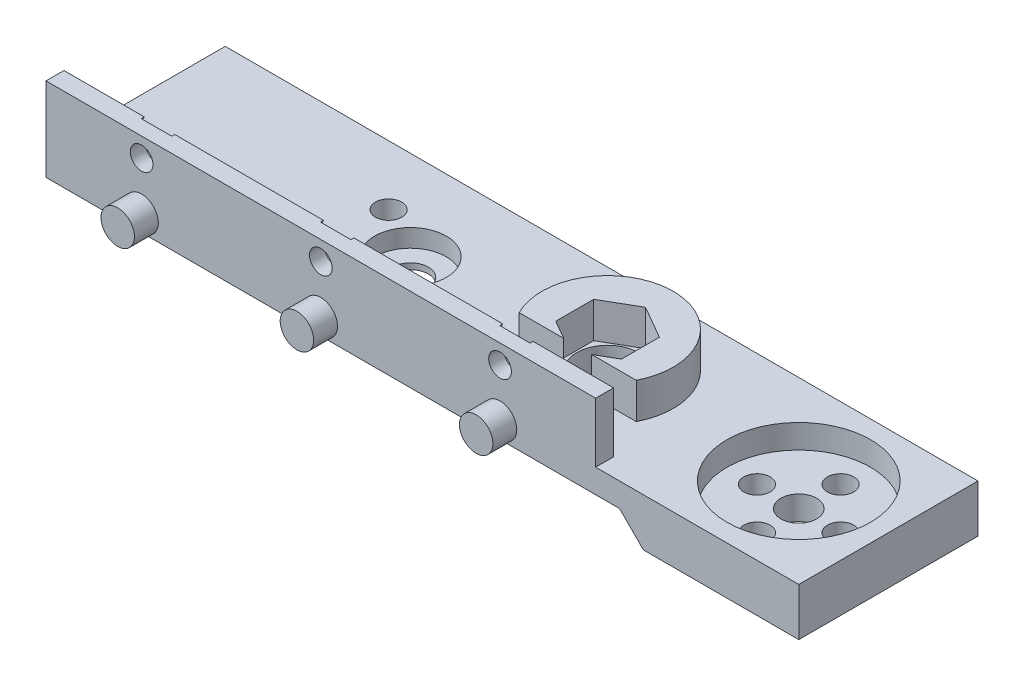
from build123d import *

# Parameters (mm, degrees)
SKETCH_1_W          = 63
SKETCH_1_H          = 15
SKETCH_1_R          = 1.1
SKETCH_1_R_2        = 1.5
SKETCH_1_R_3        = 2.6
EXTRUDE_1_DEPTH     = 2
EXTRUDE_2_DEPTH     = 2
SKETCH_4_R          = 3
CUT_EXTRUDE_1_DEPTH = 1.5
SKETCH_5_W          = 46
SKETCH_5_H          = 1.5
EXTRUDE_3_DEPTH     = 5
SKETCH_2_3_R        = 0.95
CUT_EXTRUDE_2_DEPTH = 6
CUT_EXTRUDE_START   = -0.25
SKETCH_7_R          = 0.95
CUT_EXTRUDE_3_DEPTH = 0.25
SKETCH_1_3_W        = 15
SKETCH_1_3_H        = 15
SKETCH_1_3_R        = 6
SKETCH_1_3_R_2      = 1.5
SKETCH_1_3_R_3      = 1.1
EXTRUDE_4_DEPTH     = 2
EXTRUDE_START       = -2
SKETCH_1_4_W        = 15
SKETCH_1_4_H        = 15
SKETCH_1_4_R        = 6
SKETCH_1_4_R_2      = 1.5
SKETCH_1_4_R_3      = 1.1
EXTRUDE_5_DEPTH     = 2
SKETCH_1_5_R        = 6
CUT_EXTRUDE_4_DEPTH = 2
CUT_EXTRUDE_5_DEPTH = 15
SKETCH_9_R          = 5.5
SKETCH_9_R_2        = 2.6
EXTRUDE_6_DEPTH     = 3
CUT_EXTRUDE_START_2 = -3
CUT_EXTRUDE_6_DEPTH = 3
CUT_EXTRUDE_START_3 = -3.5
CUT_EXTRUDE_7_DEPTH = 3.5
EXTRUDE_START_2     = -4
SKETCH_9_2_R        = 5.5
SKETCH_9_2_R_2      = 2.6
EXTRUDE_7_DEPTH     = 4


with BuildPart() as part:
    # 草图1 → 凸台-拉伸1 (new body)
    with BuildSketch(Plane(origin=(0, 0, 0), x_dir=(1, 0, 0), z_dir=(0, 1, 0))):
        Rectangle(SKETCH_1_W, SKETCH_1_H)
        with Locations(Location((-4.169872981, -2.5, 0), (0, 0, 270))):
            Circle(SKETCH_1_R, mode=Mode.SUBTRACT)
        with Locations(Location((-8.5, 0, 0), (0, 0, 270))):
            Circle(SKETCH_1_R_2, mode=Mode.SUBTRACT)
        with Locations(Location((-12.830127019, 2.5, 0), (0, 0, 270))):
            Circle(SKETCH_1_R, mode=Mode.SUBTRACT)
        with Locations(Location((8, 0, 0), (0, 0, 270))):
            Circle(SKETCH_1_R_3, mode=Mode.SUBTRACT)
        with Locations(Location((24, 3.5, 0), (0, 0, 270))):
            Circle(SKETCH_1_R, mode=Mode.SUBTRACT)
        with Locations(Location((24, -3.5, 0), (0, 0, 270))):
            Circle(SKETCH_1_R, mode=Mode.SUBTRACT)
        with Locations(Location((20.5, 0, 0), (0, 0, 270))):
            Circle(SKETCH_1_R, mode=Mode.SUBTRACT)
        with Locations(Location((24, 0, 0), (0, 0, 270))):
            Circle(SKETCH_1_R_2, mode=Mode.SUBTRACT)
        with Locations(Location((27.5, 0, 0), (0, 0, 270))):
            Circle(SKETCH_1_R, mode=Mode.SUBTRACT)
    extrude(amount=EXTRUDE_1_DEPTH)

    # 草图2 → 凸台-拉伸2 (add)
    with BuildSketch(Plane.XY.offset(7.5)):
        with BuildLine():
            Line((-22.1, 1.4), (-24.9, 1.4))
            ThreePointArc((-24.9, 1.4), (-23.5, 0), (-22.1, 1.4))
        make_face()
        with BuildLine():
            ThreePointArc((-24.764911064, 2), (-24.865810289, 1.707509764), (-24.9, 1.4))
            Line((-24.9, 1.4), (-22.1, 1.4))
            ThreePointArc((-22.1, 1.4), (-22.134189711, 1.707509764), (-22.235088936, 2))
            Line((-22.235088936, 2), (-24.764911064, 2))
        make_face()
        with BuildLine():
            ThreePointArc((-22.235088936, 2), (-23.5, 2.8), (-24.764911064, 2))
            Line((-24.764911064, 2), (-22.235088936, 2))
        make_face()
        with BuildLine():
            Line((-7.1, 1.4), (-9.9, 1.4))
            ThreePointArc((-9.9, 1.4), (-8.5, 0), (-7.1, 1.4))
        make_face()
        with BuildLine():
            ThreePointArc((-9.764911064, 2), (-9.865810289, 1.707509764), (-9.9, 1.4))
            Line((-9.9, 1.4), (-7.1, 1.4))
            ThreePointArc((-7.1, 1.4), (-7.134189711, 1.707509764), (-7.235088936, 2))
            Line((-7.235088936, 2), (-9.764911064, 2))
        make_face()
        with BuildLine():
            ThreePointArc((-7.235088936, 2), (-8.5, 2.8), (-9.764911064, 2))
            Line((-9.764911064, 2), (-7.235088936, 2))
        make_face()
        with BuildLine():
            Line((7.9, 1.4), (5.1, 1.4))
            ThreePointArc((5.1, 1.4), (6.5, 0), (7.9, 1.4))
        make_face()
        with BuildLine():
            ThreePointArc((5.235088936, 2), (5.134189711, 1.707509764), (5.1, 1.4))
            Line((5.1, 1.4), (7.9, 1.4))
            ThreePointArc((7.9, 1.4), (7.865810289, 1.707509764), (7.764911064, 2))
            Line((7.764911064, 2), (5.235088936, 2))
        make_face()
        with BuildLine():
            ThreePointArc((7.764911064, 2), (6.5, 2.8), (5.235088936, 2))
            Line((5.235088936, 2), (7.764911064, 2))
        make_face()
    extrude(amount=EXTRUDE_2_DEPTH)

    # 草图4 → 切除-拉伸1 (cut)
    with BuildSketch(Plane(origin=(0, 2, 0), x_dir=(1, 0, 0), z_dir=(0, 1, 0))):
        with Locations(Location((-8.5, 0, 0), (0, 0, 270))):
            Circle(SKETCH_4_R)
    extrude(amount=-CUT_EXTRUDE_1_DEPTH, mode=Mode.SUBTRACT)

    # 草图5 → 凸台-拉伸3 (add)
    with BuildSketch(Plane(origin=(0, 2, 0), x_dir=(1, 0, 0), z_dir=(0, 1, 0))):
        with Locations((-8.5, -6.75)):
            Rectangle(SKETCH_5_W, SKETCH_5_H)
    extrude(amount=EXTRUDE_3_DEPTH)

    # 草图2<3> → 切除-拉伸2 (cut)
    with BuildSketch(Plane.XY.offset(7.5)):
        with Locations((-23.5, 5.4)):
            Circle(SKETCH_2_3_R)
        with Locations((-8.5, 5.4)):
            Circle(SKETCH_2_3_R)
        with Locations((6.5, 5.4)):
            Circle(SKETCH_2_3_R)
    extrude(amount=-CUT_EXTRUDE_2_DEPTH, mode=Mode.SUBTRACT)

    # 草图7 → 切除-拉伸3 (cut)
    # profile 1 of 3: a face of its own
    with BuildSketch(Plane(origin=(0, 0, 6), x_dir=(-1, 0, 0), z_dir=(0, 0, -1)).offset(CUT_EXTRUDE_START)):
        Polygon((-7.596965511, 3.5), (-5.403034489, 3.5), (-4.306068977, 5.4), (-5.403034489, 7.3), (-7.596965511, 7.3), (-8.693931023, 5.4), align=None)
        with Locations(Location((-6.5, 5.4, 0), (0, 0, 180))):
            Circle(SKETCH_7_R, mode=Mode.SUBTRACT)
    # profile 2 of 3: a face of its own
    with BuildSketch(Plane(origin=(0, 0, 6), x_dir=(-1, 0, 0), z_dir=(0, 0, -1)).offset(CUT_EXTRUDE_START)):
        Polygon((6.306068977, 5.4), (7.403034489, 3.5), (9.596965511, 3.5), (10.693931023, 5.4), (9.596965511, 7.3), (7.403034489, 7.3), align=None)
        with Locations(Location((8.5, 5.4, 0), (0, 0, 180))):
            Circle(SKETCH_7_R, mode=Mode.SUBTRACT)
    # profile 3 of 3: a face of its own
    with BuildSketch(Plane(origin=(0, 0, 6), x_dir=(-1, 0, 0), z_dir=(0, 0, -1)).offset(CUT_EXTRUDE_START)):
        Polygon((21.306068977, 5.4), (22.403034489, 3.5), (24.596965511, 3.5), (25.693931023, 5.4), (24.596965511, 7.3), (22.403034489, 7.3), align=None)
    extrude(amount=CUT_EXTRUDE_3_DEPTH, mode=Mode.SUBTRACT)

    # 草图1<3> → 凸台-拉伸4 (add)
    # profile 1 of 2: a face of its own
    with BuildSketch(Plane(origin=(0, 0, 0), x_dir=(1, 0, 0), z_dir=(0, 1, 0))):
        with Locations((24, 0)):
            Rectangle(SKETCH_1_3_W, SKETCH_1_3_H)
        with Locations((24, 0)):
            Circle(SKETCH_1_3_R, mode=Mode.SUBTRACT)
    # profile 2 of 2: a face of its own
    with BuildSketch(Plane(origin=(0, 0, 0), x_dir=(1, 0, 0), z_dir=(0, 1, 0))):
        with Locations((24, 0)):
            Circle(SKETCH_1_3_R)
        with Locations(Location((24, 0, 0), (0, 0, 270))):
            Circle(SKETCH_1_3_R_2, mode=Mode.SUBTRACT)
        with Locations(Location((27.5, 0, 0), (0, 0, 270))):
            Circle(SKETCH_1_3_R_3, mode=Mode.SUBTRACT)
        with Locations(Location((24, -3.5, 0), (0, 0, 270))):
            Circle(SKETCH_1_3_R_3, mode=Mode.SUBTRACT)
        with Locations(Location((20.5, 0, 0), (0, 0, 270))):
            Circle(SKETCH_1_3_R_3, mode=Mode.SUBTRACT)
        with Locations(Location((24, 3.5, 0), (0, 0, 270))):
            Circle(SKETCH_1_3_R_3, mode=Mode.SUBTRACT)
    extrude(amount=EXTRUDE_4_DEPTH)

    # 草图1<4> → 凸台-拉伸5 (add)
    # profile 1 of 2: a face of its own
    with BuildSketch(Plane(origin=(0, 0, 0), x_dir=(1, 0, 0), z_dir=(0, 1, 0)).offset(EXTRUDE_START)):
        with Locations((24, 0)):
            Rectangle(SKETCH_1_4_W, SKETCH_1_4_H)
        with Locations((24, 0)):
            Circle(SKETCH_1_4_R, mode=Mode.SUBTRACT)
    # profile 2 of 2: a face of its own
    with BuildSketch(Plane(origin=(0, 0, 0), x_dir=(1, 0, 0), z_dir=(0, 1, 0)).offset(EXTRUDE_START)):
        with Locations((24, 0)):
            Circle(SKETCH_1_4_R)
        with Locations(Location((24, 0, 0), (0, 0, 270))):
            Circle(SKETCH_1_4_R_2, mode=Mode.SUBTRACT)
        with Locations(Location((27.5, 0, 0), (0, 0, 270))):
            Circle(SKETCH_1_4_R_3, mode=Mode.SUBTRACT)
        with Locations(Location((24, -3.5, 0), (0, 0, 270))):
            Circle(SKETCH_1_4_R_3, mode=Mode.SUBTRACT)
        with Locations(Location((20.5, 0, 0), (0, 0, 270))):
            Circle(SKETCH_1_4_R_3, mode=Mode.SUBTRACT)
        with Locations(Location((24, 3.5, 0), (0, 0, 270))):
            Circle(SKETCH_1_4_R_3, mode=Mode.SUBTRACT)
    extrude(amount=EXTRUDE_5_DEPTH)

    # 草图1<5> → 切除-拉伸4 (cut)
    with BuildSketch(Plane(origin=(0, 0, 0), x_dir=(1, 0, 0), z_dir=(0, 1, 0))):
        with Locations(Location((24, 0, 0), (0, 0, 270))):
            Circle(SKETCH_1_5_R)
    extrude(amount=CUT_EXTRUDE_4_DEPTH, mode=Mode.SUBTRACT)

    # 草图8 → 切除-拉伸5 (cut)
    with BuildSketch(Plane(origin=(0, 0, -7.5), x_dir=(-1, 0, 0), z_dir=(0, 0, -1))):
        Polygon((-16.5, 0), (-18.5, -2), (-16.5, -2), align=None)
    extrude(amount=-CUT_EXTRUDE_5_DEPTH, mode=Mode.SUBTRACT)

    # 草图9 → 凸台-拉伸6 (add)
    with BuildSketch(Plane(origin=(0, 2, 0), x_dir=(1, 0, 0), z_dir=(0, 1, 0))):
        with Locations(Location((8, 0, 0), (0, 0, 270))):
            Circle(SKETCH_9_R)
        with Locations(Location((8, 0, 0), (0, 0, 270))):
            Circle(SKETCH_9_R_2, mode=Mode.SUBTRACT)
    extrude(amount=EXTRUDE_6_DEPTH)

    # 草图10 → 切除-拉伸6 (cut)
    with BuildSketch(Plane(origin=(0, 5, 0), x_dir=(1, 0, 0), z_dir=(0, 1, 0)).offset(CUT_EXTRUDE_START_2)):
        with BuildLine():
            Line((8, -3.175426481), (6.830127019, -2.5))
            Line((6.830127019, -2.5), (3.101020514, -2.5))
            ThreePointArc((3.101020514, -2.5), (8, -5.5), (12.898979486, -2.5))
            Line((12.898979486, -2.5), (9.169872981, -2.5))
            Line((9.169872981, -2.5), (8, -3.175426481))
        make_face()
        with BuildLine():
            Line((7.285857157, -2.5), (6.830127019, -2.5))
            Line((6.830127019, -2.5), (8, -3.175426481))
            Line((8, -3.175426481), (9.169872981, -2.5))
            Line((9.169872981, -2.5), (8.714142843, -2.5))
            ThreePointArc((8.714142843, -2.5), (8, -2.6), (7.285857157, -2.5))
        make_face()
    extrude(amount=CUT_EXTRUDE_6_DEPTH, mode=Mode.SUBTRACT)

    # 草图10<3> → 切除-拉伸7 (cut)
    with BuildSketch(Plane(origin=(0, 5, 0), x_dir=(1, 0, 0), z_dir=(0, 1, 0)).offset(CUT_EXTRUDE_START_3)):
        with BuildLine():
            Line((10.75, 1.58771324), (8, 3.175426481))
            Line((8, 3.175426481), (5.25, 1.58771324))
            Line((5.25, 1.58771324), (5.25, -1.58771324))
            Line((5.25, -1.58771324), (6.830127019, -2.5))
            Line((6.830127019, -2.5), (7.285857157, -2.5))
            ThreePointArc((7.285857157, -2.5), (6.43423683, 2.075665121), (10.6, 0))
            ThreePointArc((10.6, 0), (10.075665121, -1.56576317), (8.714142843, -2.5))
            Line((8.714142843, -2.5), (9.169872981, -2.5))
            Line((9.169872981, -2.5), (10.75, -1.58771324))
            Line((10.75, -1.58771324), (10.75, 1.58771324))
        make_face()
    extrude(amount=CUT_EXTRUDE_7_DEPTH, mode=Mode.SUBTRACT)

    # 草图9<2> → 凸台-拉伸7 (add)
    with BuildSketch(Plane(origin=(0, 2, 0), x_dir=(1, 0, 0), z_dir=(0, 1, 0)).offset(EXTRUDE_START_2)):
        with Locations(Location((8, 0, 0), (0, 0, 270))):
            Circle(SKETCH_9_2_R)
        with Locations(Location((8, 0, 0), (0, 0, 270))):
            Circle(SKETCH_9_2_R_2, mode=Mode.SUBTRACT)
    extrude(amount=EXTRUDE_7_DEPTH)


solid = part.part
